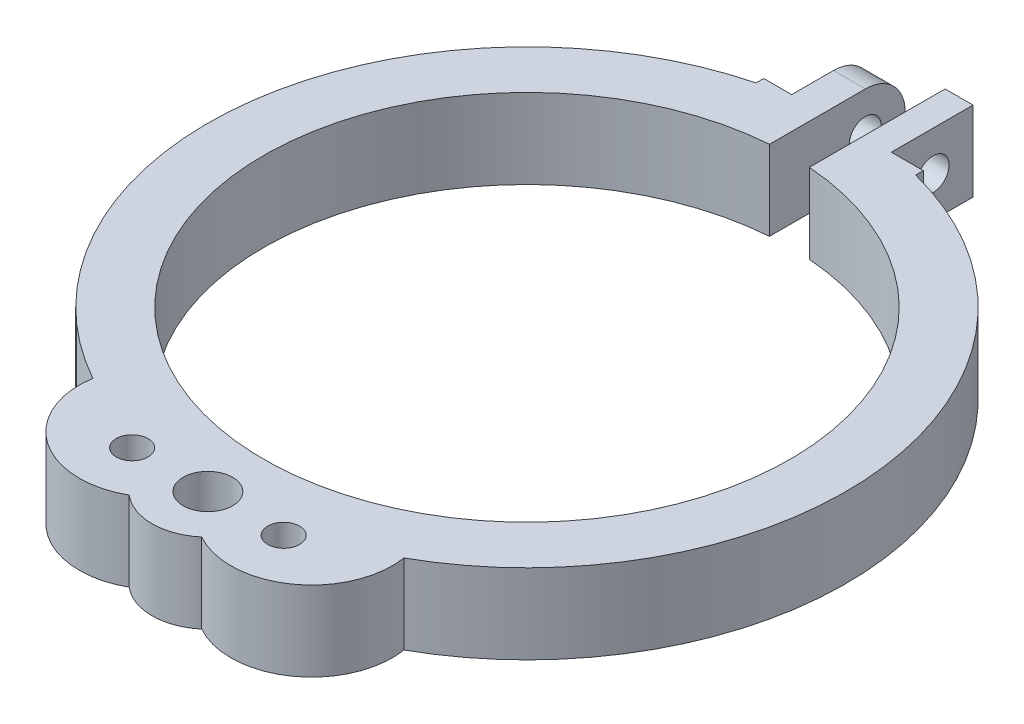
from build123d import *

# Parameters (mm, degrees)
SALIENTE_EXTRUIR1_DEPTH  = 10
SALIENTE_EXTRUIR2_START  = -10
SALIENTE_EXTRUIR2_DEPTH  = 10
CROQUIS8_R               = 2
CORTAR_EXTRUIR1_DEPTH    = 10
CROQUIS10_R              = 3.1
CORTAR_EXTRUIR3_DEPTH    = 10
CROQUIS11_W              = 2.5
CROQUIS11_H              = 10
SALIENTE_EXTRUIR5_DEPTH  = 5
CROQUIS13_R              = 2
CORTAR_EXTRUIR4_DEPTH    = 2.5
CROQUIS14_W              = 2.5
CROQUIS14_H              = 10
SALIENTE_EXTRUIR7_DEPTH  = 10
CORTAR_EXTRUIR5_START    = 10
CROQUIS15_R              = 2
CORTAR_EXTRUIR5_DEPTH    = 10
CROQUIS12_R              = 5
CROQUIS12_R_2            = 2
SALIENTE_EXTRUIR8_DEPTH  = 4
SALIENTE_EXTRUIR9_DEPTH  = 1.5
SALIENTE_EXTRUIR10_START = 1
CROQUIS17_W              = 10.235528891
CROQUIS17_H              = 10
CROQUIS17_R              = 2
SALIENTE_EXTRUIR10_DEPTH = 1


with BuildPart() as part:
    # Croquis1 → Saliente-Extruir1 (new body)
    with BuildSketch(Plane(origin=(0, 0, 0), x_dir=(1, 0, 0), z_dir=(0, 1, 0))):
        with BuildLine():
            Line((10, 38.729833462), (10, 32.619012861))
            Line((10, 32.619012861), (10, 31.448370387))
            ThreePointArc((10, 31.448370387), (26.636441204, 19.480759739), (33, 0))
            ThreePointArc((33, 0), (-19.480759739, -26.636441204), (-10, 31.448370387))
            Line((-10, 31.448370387), (-10, 38.729833462))
            ThreePointArc((-10, 38.729833462), (-24.494897428, -31.622776602), (40, 0))
            ThreePointArc((40, 0), (31.622776602, 24.494897428), (10, 38.729833462))
        make_face()
        with BuildLine():
            ThreePointArc((-10, 31.448370387), (-7.522805391, 32.131097072), (-5, 32.619012861))
            Line((-5, 32.619012861), (-5, 39.686269666))
            ThreePointArc((-5, 39.686269666), (-7.515230705, 39.287673734), (-10, 38.729833462))
            Line((-10, 38.729833462), (-10, 31.448370387))
        make_face()
        with BuildLine():
            Line((5, 39.686269666), (5, 32.619012861))
            Line((5, 32.619012861), (10, 32.619012861))
            Line((10, 32.619012861), (10, 38.729833462))
            ThreePointArc((10, 38.729833462), (7.515230705, 39.287673734), (5, 39.686269666))
        make_face()
        with BuildLine():
            Line((10, 39.686269666), (5, 39.686269666))
            ThreePointArc((5, 39.686269666), (7.515230705, 39.287673734), (10, 38.729833462))
            Line((10, 38.729833462), (10, 39.686269666))
        make_face()
        with BuildLine():
            ThreePointArc((-10, 38.729833462), (-7.515230705, 39.287673734), (-5, 39.686269666))
            Line((-5, 39.686269666), (-10, 39.686269666))
            Line((-10, 39.686269666), (-10, 38.729833462))
        make_face()
        with BuildLine():
            Line((10, 32.619012861), (5, 32.619012861))
            ThreePointArc((5, 32.619012861), (7.522805391, 32.131097072), (10, 31.448370387))
            Line((10, 31.448370387), (10, 32.619012861))
        make_face()
        with BuildLine():
            ThreePointArc((-5, 32.619012861), (-3.752728476, 32.785927301), (-2.5, 32.905166768))
            Line((-2.5, 32.905166768), (-2.5, 39.921798557))
            ThreePointArc((-2.5, 39.921798557), (-3.751848673, 39.823656682), (-5, 39.686269666))
            Line((-5, 39.686269666), (-5, 32.619012861))
        make_face()
        with BuildLine():
            ThreePointArc((-5, 39.686269666), (-3.751848673, 39.823656682), (-2.5, 39.921798557))
            Line((-2.5, 39.921798557), (-5, 39.921798557))
            Line((-5, 39.921798557), (-5, 39.686269666))
        make_face()
        with BuildLine():
            Line((2.5, 39.921798557), (2.5, 32.905166768))
            ThreePointArc((2.5, 32.905166768), (3.752728476, 32.785927301), (5, 32.619012861))
            Line((5, 32.619012861), (5, 39.686269666))
            ThreePointArc((5, 39.686269666), (3.751848673, 39.823656682), (2.5, 39.921798557))
        make_face()
        with BuildLine():
            Line((5, 39.921798557), (2.5, 39.921798557))
            ThreePointArc((2.5, 39.921798557), (3.751848673, 39.823656682), (5, 39.686269666))
            Line((5, 39.686269666), (5, 39.921798557))
        make_face()
    extrude(amount=SALIENTE_EXTRUIR1_DEPTH)

    # Croquis2 → Saliente-Extruir2 (add)
    with BuildSketch(Plane(origin=(0, 10, 0), x_dir=(1, 0, 0), z_dir=(0, 1, 0)).offset(SALIENTE_EXTRUIR2_START)):
        with BuildLine():
            ThreePointArc((4.541463415, -45.326829268), (15.280033507, -44.812112406), (19.500878735, -34.924428822))
            ThreePointArc((19.500878735, -34.924428822), (0, -40), (-19.500878735, -34.924428822))
            ThreePointArc((-19.500878735, -34.924428822), (-15.280033507, -44.812112406), (-4.541463415, -45.326829268))
            ThreePointArc((-4.541463415, -45.326829268), (0, -47), (4.541463415, -45.326829268))
        make_face()
    extrude(amount=SALIENTE_EXTRUIR2_DEPTH)

    # Croquis8 → Cortar-Extruir1 (cut)
    with BuildSketch(Plane(origin=(0, 10, 0), x_dir=(1, 0, 0), z_dir=(0, 1, 0))):
        with Locations(Location((9.5, -40, 0), (0, 0, 270))):
            Circle(CROQUIS8_R)
        with Locations(Location((-9.5, -40, 0), (0, 0, 270))):
            Circle(CROQUIS8_R)
    extrude(amount=-CORTAR_EXTRUIR1_DEPTH, mode=Mode.SUBTRACT)

    # Croquis10 → Cortar-Extruir3 (cut)
    with BuildSketch(Plane(origin=(0, 10, 0), x_dir=(1, 0, 0), z_dir=(0, 1, 0))):
        with Locations(Location((0, -40, 0), (0, 0, 270))):
            Circle(CROQUIS10_R)
    extrude(amount=-CORTAR_EXTRUIR3_DEPTH, mode=Mode.SUBTRACT)

    # Croquis11 → Saliente-Extruir5 (add)
    with BuildSketch(Plane(origin=(0, 0, -39.921798557), x_dir=(-1, 0, 0), z_dir=(0, 0, -1))):
        with Locations((3.75, 5)):
            Rectangle(CROQUIS11_W, CROQUIS11_H)
    extrude(amount=SALIENTE_EXTRUIR5_DEPTH)

    # Croquis13 → Cortar-Extruir4 (cut)
    with BuildSketch(Plane(origin=(-2.5, 0, 0), x_dir=(0, 0, -1), z_dir=(1, 0, 0))):
        with Locations((44.921798557, 5)):
            Circle(CROQUIS13_R)
    extrude(amount=-CORTAR_EXTRUIR4_DEPTH, mode=Mode.SUBTRACT)

    # Croquis14 → Saliente-Extruir7 (add)
    with BuildSketch(Plane(origin=(0, 0, -39.921798557), x_dir=(-1, 0, 0), z_dir=(0, 0, -1))):
        with Locations((-3.75, 5)):
            Rectangle(CROQUIS14_W, CROQUIS14_H)
    extrude(amount=SALIENTE_EXTRUIR7_DEPTH)

    # Croquis15 → Cortar-Extruir5 (cut)
    with BuildSketch(Plane(origin=(-2.5, 0, 0), x_dir=(0, 0, -1), z_dir=(1, 0, 0)).offset(CORTAR_EXTRUIR5_START)):
        with Locations(Location((44.921798557, 5, 0), (0, 0, 180))):
            Circle(CROQUIS15_R)
    extrude(amount=-CORTAR_EXTRUIR5_DEPTH, mode=Mode.SUBTRACT)

    # Croquis12 → Saliente-Extruir8 (add)
    with BuildSketch(Plane(origin=(-2.5, 0, 0), x_dir=(0, 0, -1), z_dir=(1, 0, 0))):
        with Locations((44.921798557, 5)):
            Circle(CROQUIS12_R)
        with Locations((44.921798557, 5)):
            Circle(CROQUIS12_R_2, mode=Mode.SUBTRACT)
    extrude(amount=-SALIENTE_EXTRUIR8_DEPTH)

    # Croquis16 → Saliente-Extruir9 (add)
    with BuildSketch(Plane.ZY.offset(5)):
        with BuildLine():
            Line((-44.921798557, 10), (-39.686269666, 10))
            Line((-39.686269666, 10), (-39.686269666, 0))
            Line((-39.686269666, 0), (-44.921798557, 0))
            ThreePointArc((-44.921798557, 0), (-39.921798557, 5), (-44.921798557, 10))
        make_face()
    extrude(amount=SALIENTE_EXTRUIR9_DEPTH)

    # Croquis17 → Saliente-Extruir10 (add)
    with BuildSketch(Plane(origin=(5, 0, 0), x_dir=(0, 0, -1), z_dir=(1, 0, 0)).offset(SALIENTE_EXTRUIR10_START)):
        with Locations((44.804034112, 5)):
            Rectangle(CROQUIS17_W, CROQUIS17_H)
        with Locations((44.921798557, 5)):
            Circle(CROQUIS17_R, mode=Mode.SUBTRACT)
    extrude(amount=-SALIENTE_EXTRUIR10_DEPTH)


solid = part.part
